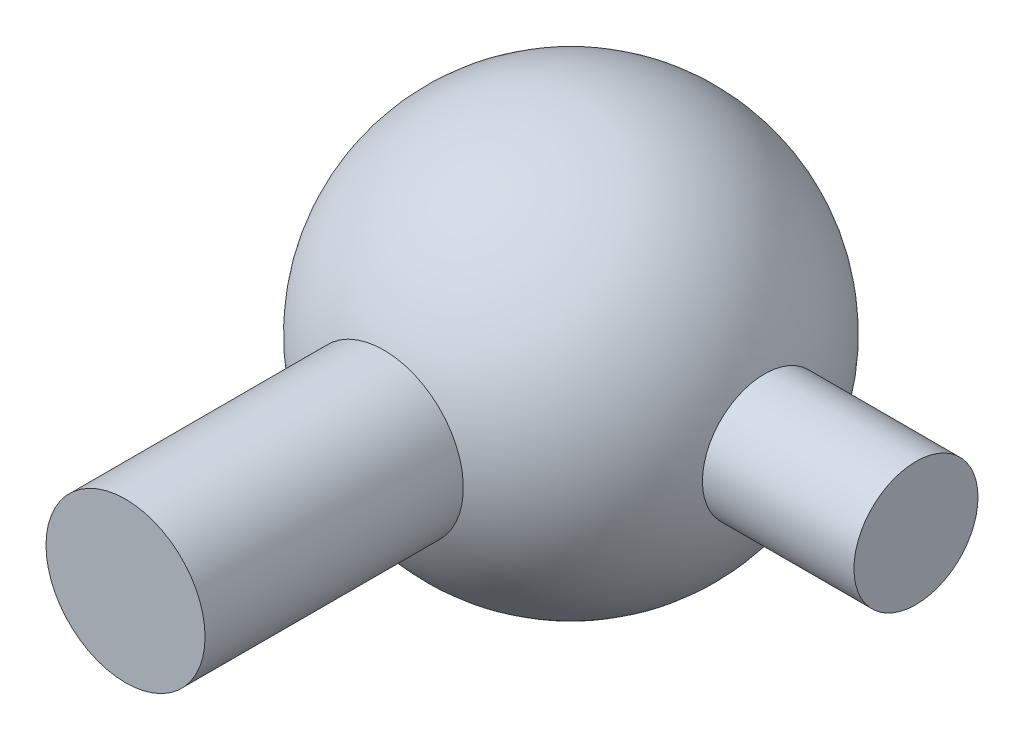
from build123d import *

# Parameters (mm, degrees)
ESQUISSE2_R        = 2.5
BOSS_EXTRU_1_DEPTH = 14
ESQUISSE3_R        = 1.95
BOSS_EXTRU_2_DEPTH = 10


with BuildPart() as part:
    # Esquisse1 → Révolution3 (revolve)
    with BuildSketch(Plane.XY):
        with BuildLine():
            Line((0, 6.389898843), (0, -6.389898843))
            ThreePointArc((0, -6.389898843), (-6.389898843, 0), (0, 6.389898843))
        make_face()
    revolve(axis=Axis((0, 0, 0), (0, 1, 0)))

    # Esquisse2 → Boss.-Extru.1 (add)
    with BuildSketch(Plane.XY):
        with Locations(Location((0, 0, 0), (0, 0, 180))):
            Circle(ESQUISSE2_R)
    extrude(amount=BOSS_EXTRU_1_DEPTH)

    # Esquisse3 → Boss.-Extru.2 (add)
    with BuildSketch(Plane(origin=(0.84709995, 0, 0), x_dir=(0, 0, -1), z_dir=(1, 0, 0))):
        with Locations(Location((0, 0, 0), (0, 0, 180))):
            Circle(ESQUISSE3_R)
    extrude(amount=BOSS_EXTRU_2_DEPTH)


solid = part.part
